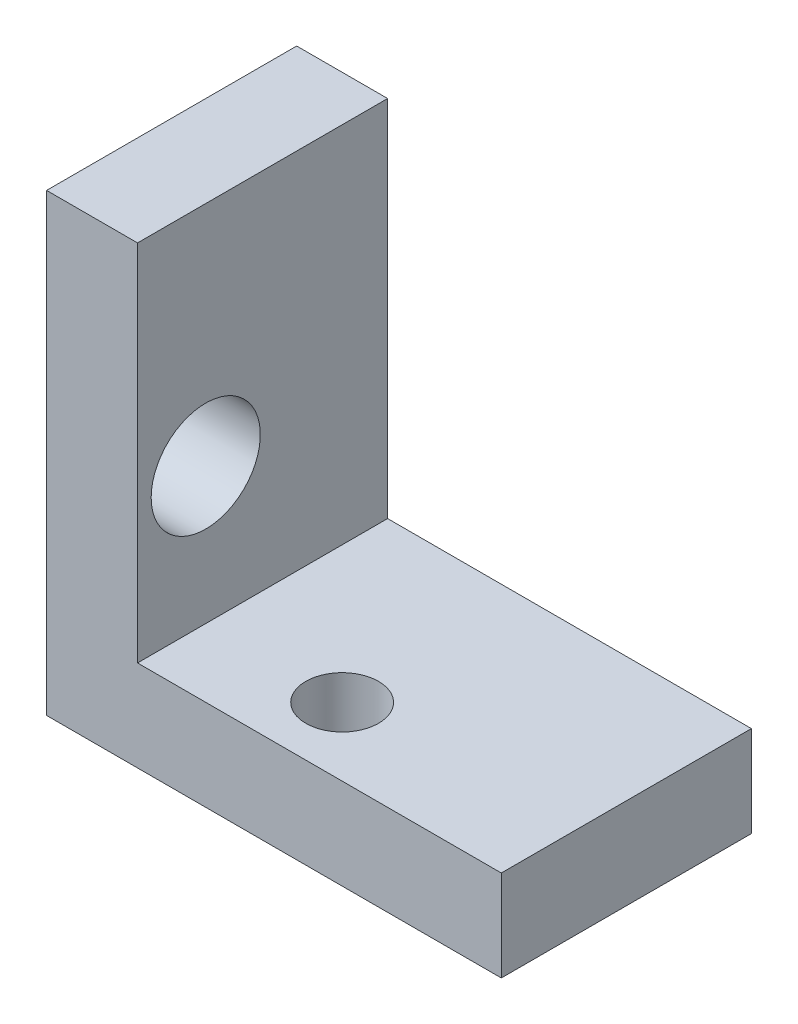
from build123d import *

# Parameters (mm, degrees)
BOSS_EXTRUDE1_DEPTH             = 5.5
M2_CLEARANCE_HOLE1_D            = 2.4
M2_CLEARANCE_HOLE1_CSINK_D      = 2.45
M2_CLEARANCE_HOLE1_CSINK_ANGLE  = 90
M2X0_4_TAPPED_HOLE1_D           = 1.6
M2X0_4_TAPPED_HOLE1_CSINK_D     = 2.45
M2X0_4_TAPPED_HOLE1_CSINK_ANGLE = 90


with BuildPart() as part:
    # Sketch1 → Boss-Extrude1 (new body)
    with BuildSketch(Plane.XY):
        Polygon((0, 0), (0, 10), (2, 10), (2, 2), (10, 2), (10, 0), align=None)
    extrude(amount=BOSS_EXTRUDE1_DEPTH)

    # M2 Clearance Hole1 (through all)
    with Locations(Plane.ZY):
        with Locations((4, 5)):
            CounterSinkHole(M2_CLEARANCE_HOLE1_D / 2, M2_CLEARANCE_HOLE1_CSINK_D / 2, counter_sink_angle=M2_CLEARANCE_HOLE1_CSINK_ANGLE)

    # M2x0.4 Tapped Hole1 (through all)
    with Locations(Plane(origin=(0, 0, 0), x_dir=(-1, 0, 0), z_dir=(0, -1, 0))):
        with Locations((-5, -4)):
            CounterSinkHole(M2X0_4_TAPPED_HOLE1_D / 2, M2X0_4_TAPPED_HOLE1_CSINK_D / 2, counter_sink_angle=M2X0_4_TAPPED_HOLE1_CSINK_ANGLE)


solid = part.part
